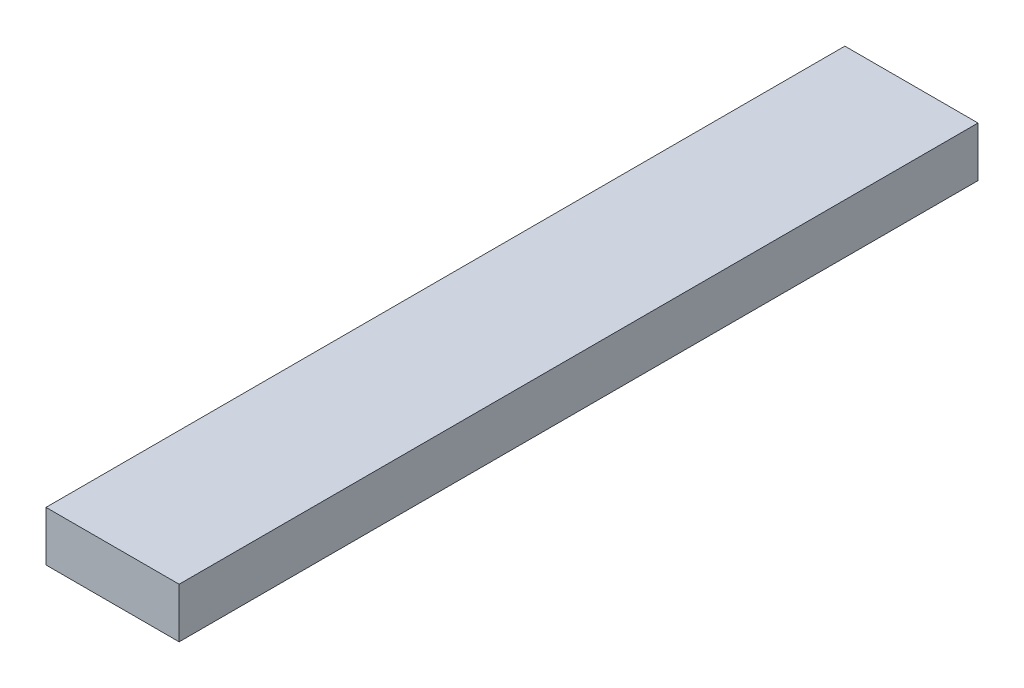
from build123d import *

# Parameters (mm, degrees)
BOSS_EXTRUDE1_DEPTH      = 76.2
BOSS_EXTRUDE1_DEPTH_BACK = 76.2
SKETCH3_W                = 25.4
SKETCH3_H                = 9.525


with BuildPart() as part:
    # Sketch3 → Boss-Extrude1 (new, two sides: drawn at the far end of the back side and taken through both)
    with BuildSketch(Plane.XY.offset(-BOSS_EXTRUDE1_DEPTH_BACK)):
        Rectangle(SKETCH3_W, SKETCH3_H)
    extrude(amount=BOSS_EXTRUDE1_DEPTH + BOSS_EXTRUDE1_DEPTH_BACK)


solid = part.part
